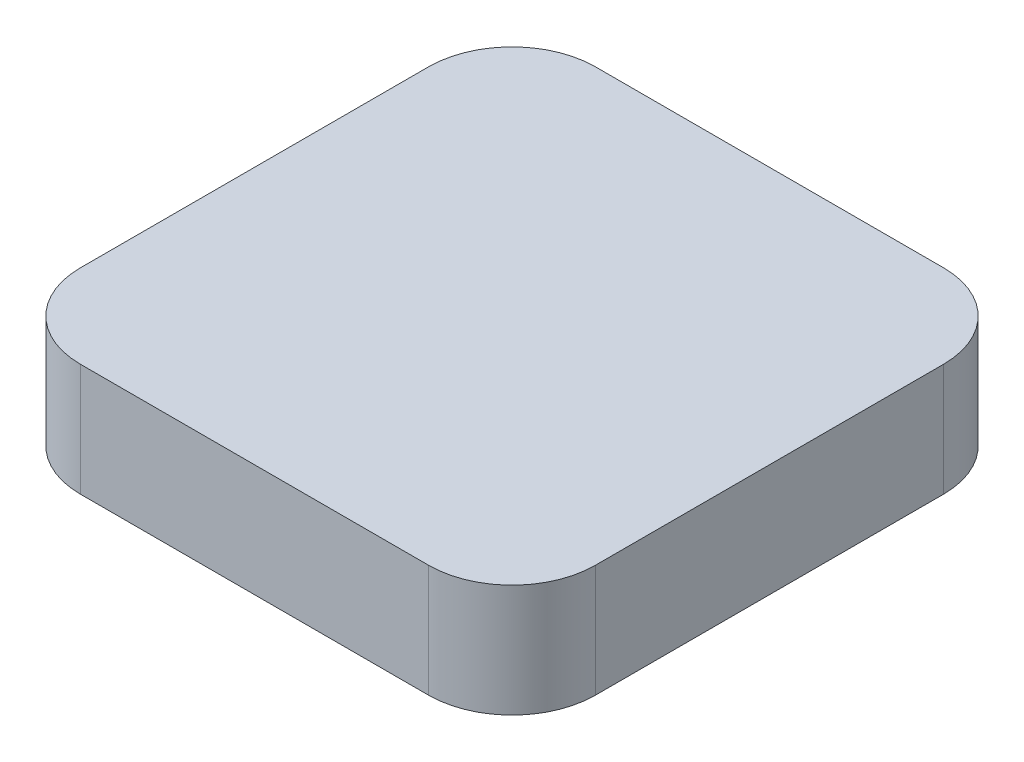
from build123d import *

# Parameters (mm, degrees)
SKETCH1_W           = 98
SKETCH1_H           = 98
BOSS_EXTRUDE1_DEPTH = 23
FILLET1_R           = 15.875
SKETCH4_W           = 12.7
SKETCH4_H           = 12.7
SKETCH4_W_2         = 15.875
CUT_EXTRUDE1_DEPTH  = 12.7


with BuildPart() as part:
    # Sketch1 → Boss-Extrude1 (new body)
    with BuildSketch(Plane(origin=(0, 0, 0), x_dir=(1, 0, 0), z_dir=(0, 1, 0))):
        Rectangle(SKETCH1_W, SKETCH1_H)
    extrude(amount=BOSS_EXTRUDE1_DEPTH)

    # Fillet1
    fillet1_edges = [part.edges().sort_by_distance(p)[0] for p in [
        (49, 11.5, 49),
        (-49, 11.5, 49),
        (-49, 11.5, -49),
        (49, 11.5, -49),
    ]]
    fillet(fillet1_edges, radius=FILLET1_R)

    # Cut-Sweep3: sweep along a path in Sketch2
    with BuildLine(Plane.XZ) as cut_sweep3_path:
        CenterArc((0, 0), 38.1, 0, 360)
    # Sketch3 → Cut-Sweep3 (sweep, cut)
    with BuildSketch(Plane.XY):
        with BuildLine():
            Line((-63.5, 0), (-63.5, 1.5875))
            Line((-63.5, 1.5875), (-49, 1.5875))
            ThreePointArc((-49, 1.5875), (-43.49250156, 1.188542436), (-38.1, 0))
            Line((-38.1, 0), (-63.5, 0))
        make_face()
    sweep(path=cut_sweep3_path.line, mode=Mode.SUBTRACT)

    # Sketch4 → Cut-Extrude1 (cut)
    with BuildSketch(Plane(origin=(0, 0, -49), x_dir=(-1, 0, 0), z_dir=(0, 0, -1))):
        with BuildLine():
            Line((-29.188, 7.69), (-26.648, 7.69))
            Line((-26.648, 7.69), (-25.976365385, 9.301923077))
            ThreePointArc((-25.976365385, 9.301923077), (-25.0605, 9.9125), (-24.144634615, 9.301923077))
            Line((-24.144634615, 9.301923077), (-23.473, 7.69))
            Line((-23.473, 7.69), (-20.933, 7.69))
            ThreePointArc((-20.933, 7.69), (-17.123, 11.5), (-20.933, 15.31))
            Line((-20.933, 15.31), (-23.473, 15.31))
            Line((-23.473, 15.31), (-24.144634615, 13.698076923))
            ThreePointArc((-24.144634615, 13.698076923), (-25.0605, 13.0875), (-25.976365385, 13.698076923))
            Line((-25.976365385, 13.698076923), (-26.648, 15.31))
            Line((-26.648, 15.31), (-29.188, 15.31))
            ThreePointArc((-29.188, 15.31), (-32.998, 11.5), (-29.188, 7.69))
        make_face()
        Polygon((-15.875, 16.707), (-3.175, 16.707), (-3.175, 15.1195), (-4.7625, 13.532), (-14.2875, 13.532), (-15.875, 15.1195), align=None)
        with Locations((7.598, 12.29375)):
            Rectangle(SKETCH4_W, SKETCH4_H)
        with Locations((25.0605, 12.29375)):
            Rectangle(SKETCH4_W_2, SKETCH4_H)
    extrude(amount=-CUT_EXTRUDE1_DEPTH, mode=Mode.SUBTRACT)


solid = part.part
